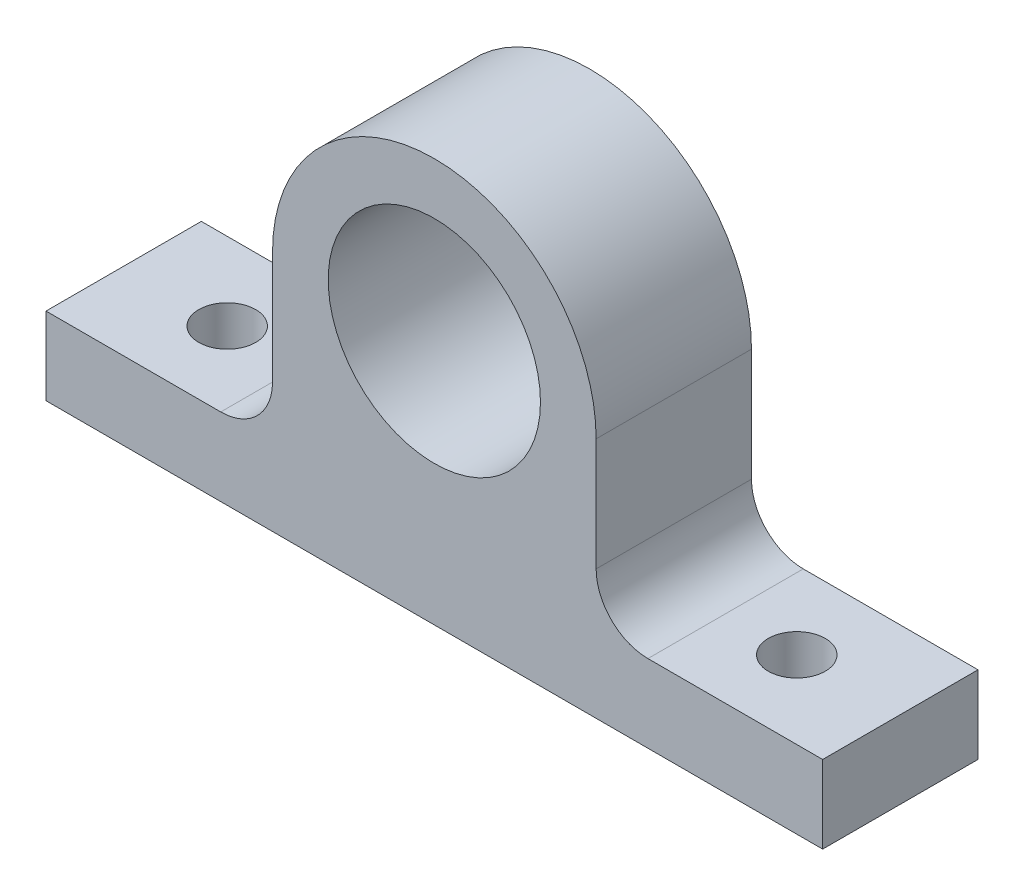
from build123d import *

# Parameters (mm, degrees)
SKETCH2_R           = 4.1
BOSS_EXTRUDE1_DEPTH = 3
FILLET1_RADIUS      = 6.25
FILLET1_LENGTH      = 6
FILLET2_R           = 2
SKETCH3_R           = 1.1
CUT_EXTRUDE1_DEPTH  = 3


with BuildPart() as part:
    # Sketch2 → Boss-Extrude1 (new, symmetric)
    with BuildSketch(Plane.XY):
        Polygon((6.25, -6.5), (15, -6.5), (15, -9.5), (-15, -9.5), (-15, -6.5), (-6.25, -6.5), (-6.25, 6.1), (6.25, 6.1), align=None)
        Circle(SKETCH2_R, mode=Mode.SUBTRACT)
    extrude(amount=BOSS_EXTRUDE1_DEPTH, both=True)

    # Fillet1: full round fillet: the end face becomes a half cylinder, R = half its width
    fillet1_face = Plane((0, 6.1, 0), x_dir=(0, 0, 1), z_dir=(0, 1, 0))  # on the end face: x along it, z out of the body
    fillet1_slab = fillet1_face.offset(-FILLET1_RADIUS / 2) * Box(FILLET1_LENGTH, 2 * FILLET1_RADIUS, FILLET1_RADIUS, mode=Mode.PRIVATE)  # the body's end, R deep
    fillet1_round = Plane((0, -0.15, 0), x_dir=(0, 1, 0), z_dir=(0, 0, 1)) * Cylinder(FILLET1_RADIUS, FILLET1_LENGTH, mode=Mode.PRIVATE)  # its axis R under the face
    add(fillet1_slab - fillet1_round, mode=Mode.SUBTRACT)

    # Fillet2
    fillet2_edges = [part.edges().sort_by_distance(p)[0] for p in [
        (6.25, -6.5, 0),
        (-6.25, -6.5, 0),
    ]]
    fillet(fillet2_edges, radius=FILLET2_R)

    # Sketch3 → Cut-Extrude1 (cut)
    with BuildSketch(Plane(origin=(0, -6.5, 0), x_dir=(1, 0, 0), z_dir=(0, 1, 0))):
        with Locations(Location((-11, 0, 0), (0, 0, 180))):
            Circle(SKETCH3_R)
        with Locations(Location((11, 0, 0), (0, 0, 180))):
            Circle(SKETCH3_R)
    extrude(amount=-CUT_EXTRUDE1_DEPTH, mode=Mode.SUBTRACT)


solid = part.part
